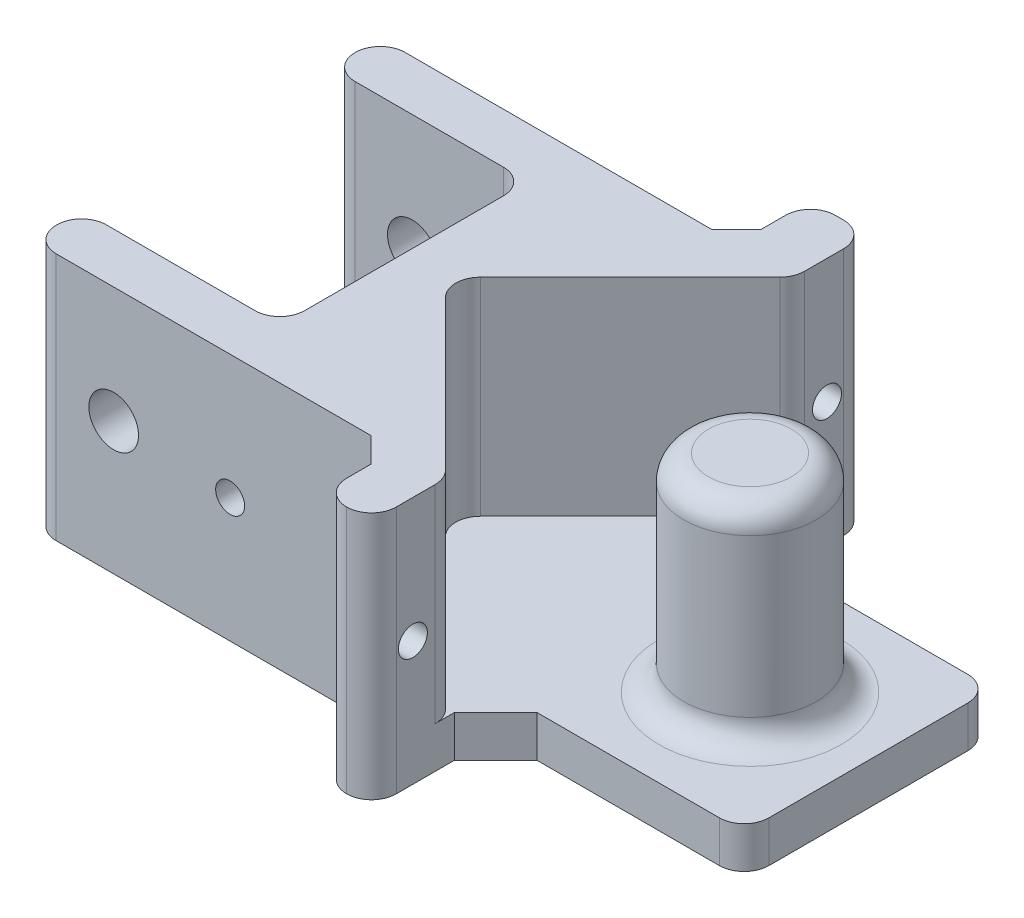
from build123d import *

# Parameters (mm, degrees)
SKETCH1_R               = 8
BOSS_EXTRUDE1_DEPTH     = 30
BOSS_EXTRUDE1_2_DEPTH   = 30
SKETCH2_W               = 30
SKETCH2_H               = 30
CUT_EXTRUDE1_DEPTH      = 30
CHAMFER1_SIZE           = 3
FILLET1_R               = 3
FILLET2_R               = 3
CUT_EXTRUDE2_DEPTH      = 30
CUT_EXTRUDE2_DEPTH_BACK = 30
SKETCH3_R               = 1.75
CUT_EXTRUDE3_DEPTH      = 50
CUT_EXTRUDE3_DEPTH_BACK = 30
SKETCH4_R               = 3
CUT_EXTRUDE4_DEPTH      = 88.933914818
CUT_EXTRUDE4_DEPTH_BACK = 88.933914818
SKETCH5_R               = 1.75
BOSS_EXTRUDE2_DEPTH     = 5
FILLET3_R               = 3
FILLET4_R               = 3
FILLET5_R               = 3
CHAMFER5_SIZE           = 5


with BuildPart() as part:
    # Sketch1 → Boss-Extrude1 (new body)
    with BuildSketch(Plane(origin=(0, 0, 0), x_dir=(1, 0, 0), z_dir=(0, 1, 0))):
        with Locations(Location((0.707106781, 0, 0), (0, 0, 270))):
            Circle(SKETCH1_R)
    extrude(amount=BOSS_EXTRUDE1_DEPTH)



with BuildPart() as body_2:
    # Sketch1 → Boss-Extrude1 2 (new body)
    with BuildSketch(Plane(origin=(0, 0, 0), x_dir=(1, 0, 0), z_dir=(0, 1, 0))):
        Polygon((-65, 21.062445841), (-65, -21.062445841), (-21.005807434, -21.062445841), (-21.005807434, -30), (-15, -30), (-15, -21.062445841), (-36.062445841, 0), (-15, 21.062445841), (-15, 30), (-22, 30), (-22, 21.062445841), align=None)
    extrude(amount=BOSS_EXTRUDE1_2_DEPTH)

    # Sketch2 → Cut-Extrude1 (cut)
    with BuildSketch(Plane(origin=(0, 30, 0), x_dir=(1, 0, 0), z_dir=(0, 1, 0))):
        with Locations((-56.062445841, 0)):
            Rectangle(SKETCH2_W, SKETCH2_H)
    extrude(amount=-CUT_EXTRUDE1_DEPTH, mode=Mode.SUBTRACT)

    # Chamfer1
    chamfer1_edges = [body_2.edges().sort_by_distance(p)[0] for p in [
        (-21.005807434, 15, 21.062445841),
        (-22, 15, -21.062445841),
    ]]
    chamfer(chamfer1_edges, length=CHAMFER1_SIZE)

    # Fillet1
    fillet1_edges = [body_2.edges().sort_by_distance(p)[0] for p in [
        (-36.062445841, 15, 0),
        (-15, 15, 21.062445841),
        (-15, 15, -21.062445841),
        (-41.062445841, 15, 15),
        (-41.062445841, 15, -15),
    ]]
    fillet(fillet1_edges, radius=FILLET1_R)

    # Fillet2
    fillet2_edges = [body_2.edges().sort_by_distance(p)[0] for p in [
        (-15, 15, 30),
        (-21.005807434, 15, 30),
        (-65, 15, 21.062445841),
        (-65, 15, -21.062445841),
        (-22, 15, -30),
        (-15, 15, -30),
        (-65, 15, 15),
        (-65, 15, -15),
    ]]
    fillet(fillet2_edges, radius=FILLET2_R)

    # Sketch3 → Cut-Extrude2 (cut, two sides: drawn at the far end of the back side and taken through both)
    with BuildSketch(Plane.ZY.offset(22).offset(-CUT_EXTRUDE2_DEPTH_BACK)):
        with Locations(Location((-25, 15, 0), (0, 0, 57.605534529))):
            Circle(SKETCH3_R)
        with Locations(Location((25, 15, 0), (0, 0, 122.394465471))):
            Circle(SKETCH3_R)
    extrude(amount=CUT_EXTRUDE2_DEPTH + CUT_EXTRUDE2_DEPTH_BACK, mode=Mode.SUBTRACT)

    # Sketch4 → Cut-Extrude3 (cut, two sides: drawn at the far end of the back side and taken through both)
    with BuildSketch(Plane.XY.offset(-15).offset(-CUT_EXTRUDE3_DEPTH_BACK)):
        with Locations(Location((-55.062445841, 15.983841749, 0), (0, 0, 180))):
            Circle(SKETCH4_R)
    extrude(amount=CUT_EXTRUDE3_DEPTH + CUT_EXTRUDE3_DEPTH_BACK, mode=Mode.SUBTRACT)

    # Sketch5 → Cut-Extrude4 (cut, two sides: drawn at the far end of the back side and taken through both)
    with BuildSketch(Plane(origin=(0, 0, -21.062445841), x_dir=(-1, 0, 0), z_dir=(0, 0, -1)).offset(-CUT_EXTRUDE4_DEPTH_BACK)):
        with Locations((41, 15)):
            Circle(SKETCH5_R)
    extrude(amount=CUT_EXTRUDE4_DEPTH + CUT_EXTRUDE4_DEPTH_BACK, mode=Mode.SUBTRACT)


with BuildPart() as part_1:
    add(part.part)

    add(body_2.part)  # Boss-Extrude2 merges body 2
    # Sketch6 → Boss-Extrude2 (add)
    with BuildSketch(Plane(origin=(0, 0, 0), x_dir=(1, 0, 0), z_dir=(0, 1, 0))):
        Polygon((-15, 15), (15, 15), (15, -15), (-15, -15), (-15, -24.652543264), (-37.297750688, -1.415722551), (-37.297750688, 2.803501212), (-15, 23.928760824), align=None)
    extrude(amount=BOSS_EXTRUDE2_DEPTH)

    # Fillet3
    fillet3_edges = [part_1.edges().sort_by_distance(p)[0] for p in [
        (0.707106781, 30, -8),
    ]]
    fillet(fillet3_edges, radius=FILLET3_R)

    # Fillet4
    fillet4_edges = [part_1.edges().sort_by_distance(p)[0] for p in [
        (15, 2.5, 15),
        (15, 2.5, -15),
    ]]
    fillet(fillet4_edges, radius=FILLET4_R)

    # Fillet5
    fillet5_edges = [part_1.edges().sort_by_distance(p)[0] for p in [
        (0.707106781, 5, -8),
    ]]
    fillet(fillet5_edges, radius=FILLET5_R)

    # Chamfer5
    chamfer5_edges = [part_1.edges().sort_by_distance(p)[0] for p in [
        (-15, 2.5, -15),
        (-15, 2.5, 15),
    ]]
    chamfer(chamfer5_edges, length=CHAMFER5_SIZE)


solid = part_1.part
